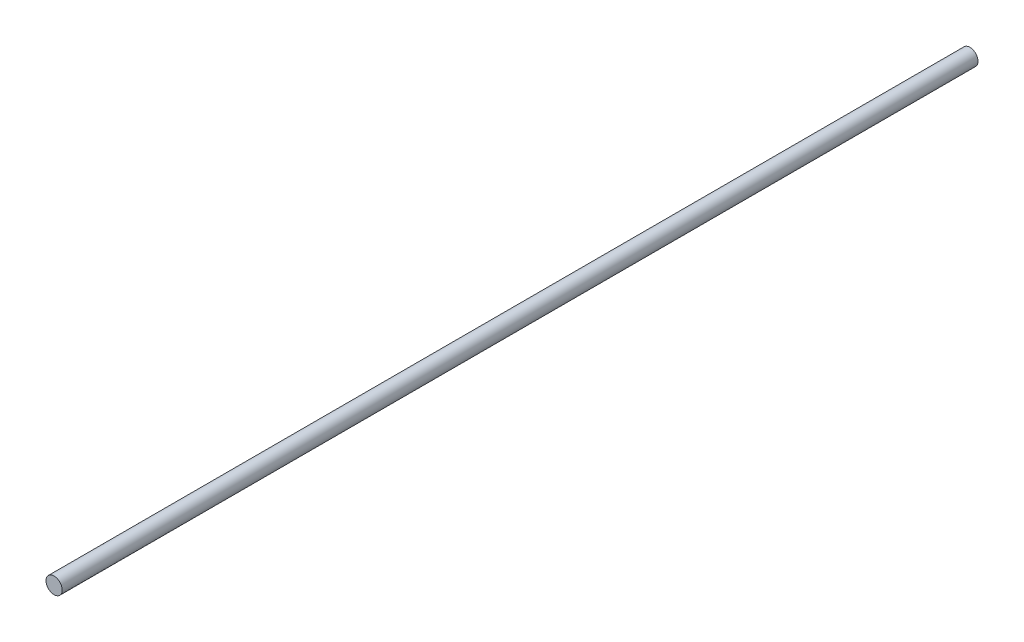
from build123d import *

# Parameters (mm, degrees)
SKETCH_1_R      = 5
EXTRUDE_1_DEPTH = 282.5


with BuildPart() as part:
    # Эскиз1 → Бобышка-Вытянуть1 (new, symmetric)
    with BuildSketch(Plane.XY):
        Circle(SKETCH_1_R)
    extrude(amount=EXTRUDE_1_DEPTH, both=True)


solid = part.part
